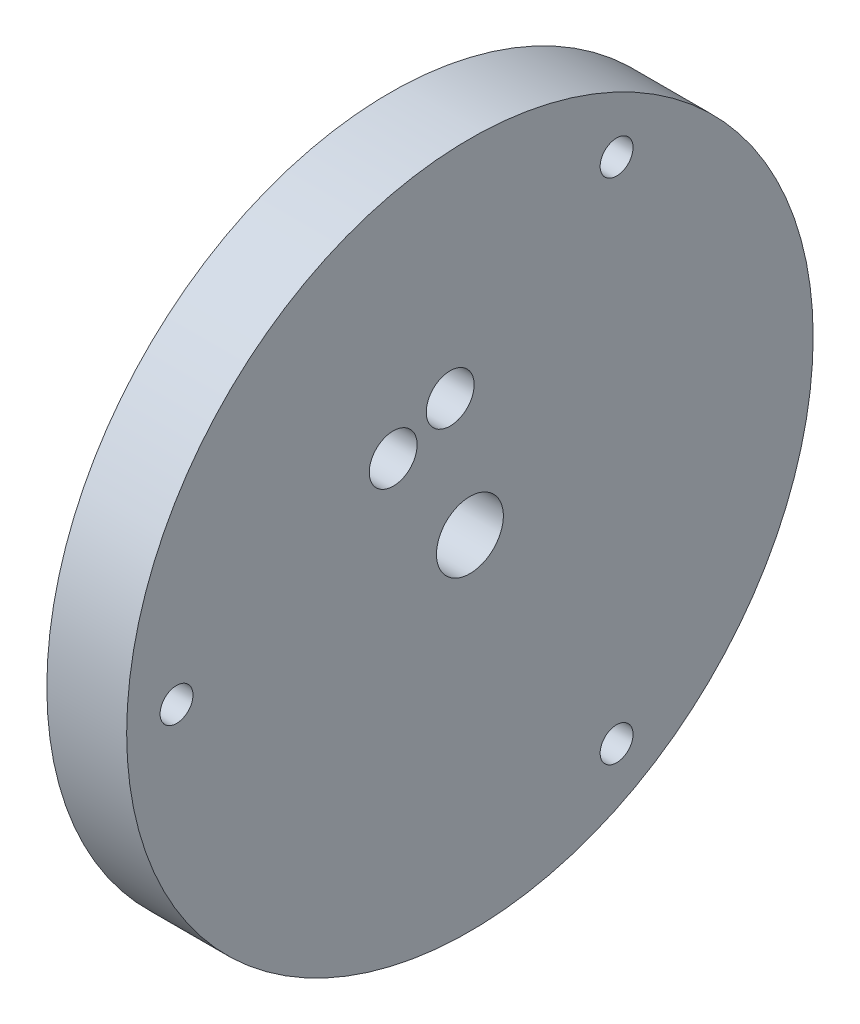
from build123d import *

# Parameters (mm, degrees)
AXIAL_PROFILE_MM_W     = 8
AXIAL_PROFILE_MM_H     = 31.05
AXIAL_HOLES_DEPTH      = 165.078060691
AXIAL_HOLES_DEPTH_BACK = 165.078060691
SKETCH2_R              = 2.4
SKETCH2_R_2            = 1.65


with BuildPart() as part:
    # Axial profile (mm) → Full revolution (revolve)
    with BuildSketch(Plane.XY, mode=Mode.PRIVATE) as full_revolution_sk:
        with Locations((152.7, 18.875)):
            Rectangle(AXIAL_PROFILE_MM_W, AXIAL_PROFILE_MM_H)
    revolve(full_revolution_sk.sketch.rotate(Axis((-110, 0, 0), (1, 0, 0)), 90), axis=Axis((-110, 0, 0), (1, 0, 0)))

    # Sketch2 → Axial holes (cut, two sides: drawn at the far end of the back side and taken through both)
    with BuildSketch(Plane(origin=(0, 0, 0), x_dir=(0, 0, -1), z_dir=(1, 0, 0)).offset(-AXIAL_HOLES_DEPTH_BACK)):
        with Locations((-1.977382665, 12.848733704)):
            Circle(SKETCH2_R)
        with Locations((-7.687206041, 10.483647423)):
            Circle(SKETCH2_R)
        with Locations((-29.4, 0)):
            Circle(SKETCH2_R_2)
        with Locations((14.7, -25.461146871)):
            Circle(SKETCH2_R_2)
        with Locations((14.7, 25.461146871)):
            Circle(SKETCH2_R_2)
    extrude(amount=AXIAL_HOLES_DEPTH + AXIAL_HOLES_DEPTH_BACK, mode=Mode.SUBTRACT)


solid = part.part
